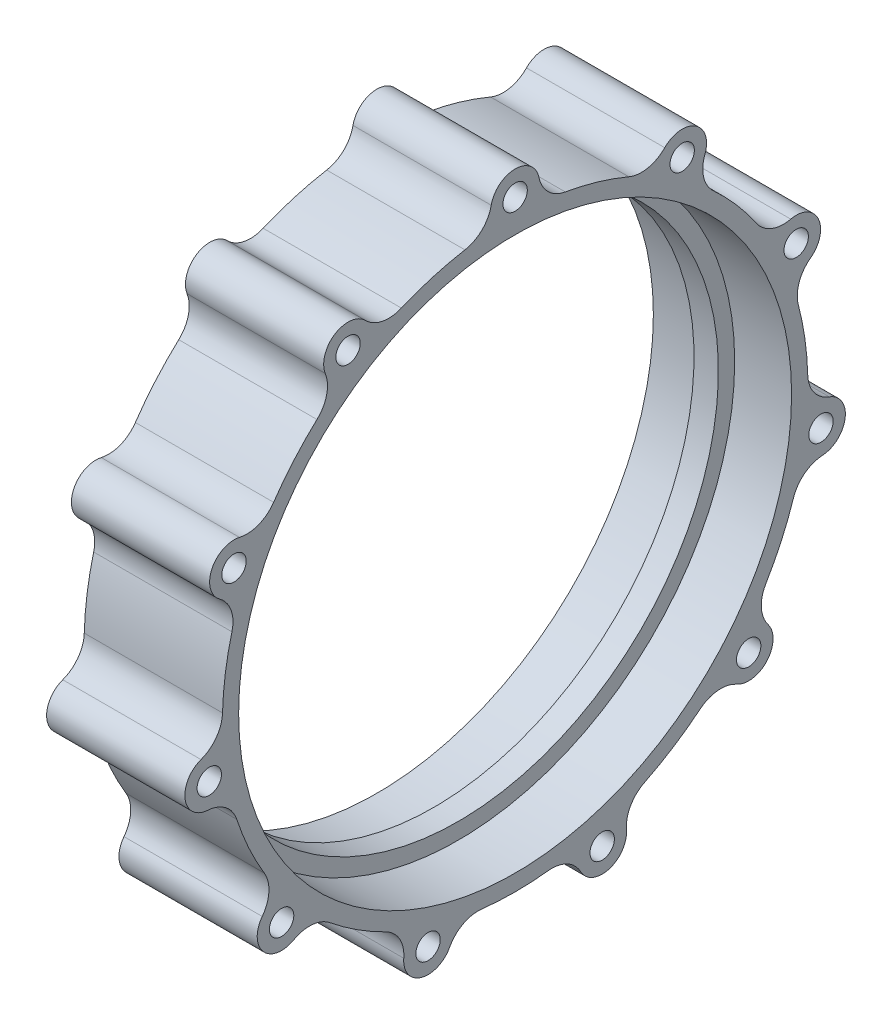
from build123d import *

# Parameters (mm, degrees)
EXTRUDE_START            = -17
EXTRUDE_1_DEPTH          = 17
FILLET_1_R               = 4
CUT_EXTRUDE_1_DEPTH      = 61.161725669
CUT_EXTRUDE_1_DEPTH_BACK = 61.161725669
SKETCH_3_R               = 1.5


with BuildPart() as part:
    # 草图1 → 旋转1 (revolve)
    with BuildSketch(Plane(origin=(0, 0, 0), x_dir=(1, 0, 0), z_dir=(0, 1, 0)), mode=Mode.PRIVATE) as revolve_1_sk:
        Polygon((0, 34), (7, 34), (7, 32), (10, 32), (10, 34), (17, 34), (17, 36), (0, 36), align=None)
    revolve(revolve_1_sk.sketch.rotate(Axis((0, 0, 0), (1, 0, 0)), 180), axis=Axis((0, 0, 0), (1, 0, 0)))

    # 草图2 → 凸台-拉伸1 (add)
    with BuildSketch(Plane(origin=(17, 0, 0), x_dir=(0, 0, -1), z_dir=(1, 0, 0)).offset(EXTRUDE_START)):
        with BuildLine():
            ThreePointArc((2.175434175, 35.934210526), (0, 41), (-2.175434175, 35.934210526))
            ThreePointArc((-2.175434175, 35.934210526), (0, 36), (2.175434175, 35.934210526))
        make_face()
        with BuildLine():
            ThreePointArc((21.257592639, 29.053653044), (19.463069428, 30.285127182), (17.597409268, 31.405910066))
            ThreePointArc((17.597409268, 31.405910066), (22.166273516, 34.491394846), (21.257592639, 29.053653044))
        make_face()
        with BuildLine():
            ThreePointArc((33.590615639, 12.948766003), (32.746751833, 14.954940468), (31.783199606, 16.906455063))
            ThreePointArc((31.783199606, 16.906455063), (37.29491181, 17.032015533), (33.590615639, 12.948766003))
        make_face()
        with BuildLine():
            ThreePointArc((35.258855513, -7.267262751), (35.633571908, -5.123334178), (35.878048639, -2.960679968))
            ThreePointArc((35.878048639, -2.960679968), (40.582679117, -5.834908369), (35.258855513, -7.267262751))
        make_face()
        with BuildLine():
            ThreePointArc((25.732657889, -25.175986931), (27.206984677, -23.574986422), (28.581870731, -21.887820027))
            ThreePointArc((28.581870731, -21.887820027), (30.985732549, -26.849290092), (25.732657889, -25.175986931))
        make_face()
        with BuildLine():
            ThreePointArc((8.036523204, -35.091513145), (10.142372046, -34.54174705), (12.211150815, -33.86573188))
            ThreePointArc((12.211150815, -33.86573188), (11.55103483, -39.339211918), (8.036523204, -35.091513145))
        make_face()
        with BuildLine():
            ThreePointArc((-12.211150815, -33.86573188), (-10.142372046, -34.54174705), (-8.036523204, -35.091513145))
            ThreePointArc((-8.036523204, -35.091513145), (-11.55103483, -39.339211918), (-12.211150815, -33.86573188))
        make_face()
        with BuildLine():
            ThreePointArc((-28.581870731, -21.887820027), (-27.206984677, -23.574986422), (-25.732657889, -25.175986931))
            ThreePointArc((-25.732657889, -25.175986931), (-30.985732549, -26.849290092), (-28.581870731, -21.887820027))
        make_face()
        with BuildLine():
            ThreePointArc((-35.878048639, -2.960679968), (-35.633571908, -5.123334178), (-35.258855513, -7.267262751))
            ThreePointArc((-35.258855513, -7.267262751), (-40.582679117, -5.834908369), (-35.878048639, -2.960679968))
        make_face()
        with BuildLine():
            ThreePointArc((-31.783199606, 16.906455063), (-32.746751833, 14.954940468), (-33.590615639, 12.948766003))
            ThreePointArc((-33.590615639, 12.948766003), (-37.29491181, 17.032015533), (-31.783199606, 16.906455063))
        make_face()
        with BuildLine():
            ThreePointArc((-17.597409268, 31.405910066), (-19.463069428, 30.285127182), (-21.257592639, 29.053653044))
            ThreePointArc((-21.257592639, 29.053653044), (-22.166273516, 34.491394846), (-17.597409268, 31.405910066))
        make_face()
    extrude(amount=EXTRUDE_1_DEPTH)

    # 圆角1
    fillet_1_edges = [part.edges().sort_by_distance(p)[0] for p in [
        (8.5, 35.934210526, -2.175434175),
        (8.5, 35.934210526, 2.175434175),
        (8.5, 31.405910066, -17.597409268),
        (8.5, 29.053653044, -21.257592639),
        (8.5, -35.091513145, 8.036523204),
        (8.5, -33.86573188, 12.211150815),
        (8.5, 16.906455063, -31.783199606),
        (8.5, 12.948766003, -33.590615639),
        (8.5, -2.960679968, -35.878048639),
        (8.5, -7.267262751, -35.258855513),
        (8.5, -21.887820027, -28.581870731),
        (8.5, -25.175986931, -25.732657889),
        (8.5, -25.175986931, 25.732657889),
        (8.5, -21.887820027, 28.581870731),
        (8.5, -33.86573188, -12.211150815),
        (8.5, -35.091513145, -8.036523204),
        (8.5, -7.267262751, 35.258855513),
        (8.5, -2.960679968, 35.878048639),
        (8.5, 12.948766003, 33.590615639),
        (8.5, 16.906455063, 31.783199606),
        (8.5, 29.053653044, 21.257592639),
        (8.5, 31.405910066, 17.597409268),
    ]]
    fillet(fillet_1_edges, radius=FILLET_1_R)

    # 草图3 → 切除-拉伸1 (cut, two sides: drawn at the far end of the back side and taken through both)
    with BuildSketch(Plane.ZY.offset(-CUT_EXTRUDE_1_DEPTH_BACK)):
        with Locations((0, 38)):
            Circle(SKETCH_3_R)
        with Locations((-10.70583716, -36.460732997)):
            Circle(SKETCH_3_R)
        with Locations((20.544351063, 31.967634248)):
            Circle(SKETCH_3_R)
        with Locations((34.566015823, 15.785770494)):
            Circle(SKETCH_3_R)
        with Locations((37.613214791, -5.407963854)):
            Circle(SKETCH_3_R)
        with Locations((28.718483825, -24.88470789)):
            Circle(SKETCH_3_R)
        with Locations((10.70583716, -36.460732997)):
            Circle(SKETCH_3_R)
        with Locations((-28.718483825, -24.88470789)):
            Circle(SKETCH_3_R)
        with Locations((-37.613214791, -5.407963854)):
            Circle(SKETCH_3_R)
        with Locations((-34.566015823, 15.785770494)):
            Circle(SKETCH_3_R)
        with Locations((-20.544351063, 31.967634248)):
            Circle(SKETCH_3_R)
    extrude(amount=CUT_EXTRUDE_1_DEPTH + CUT_EXTRUDE_1_DEPTH_BACK, mode=Mode.SUBTRACT)


solid = part.part
